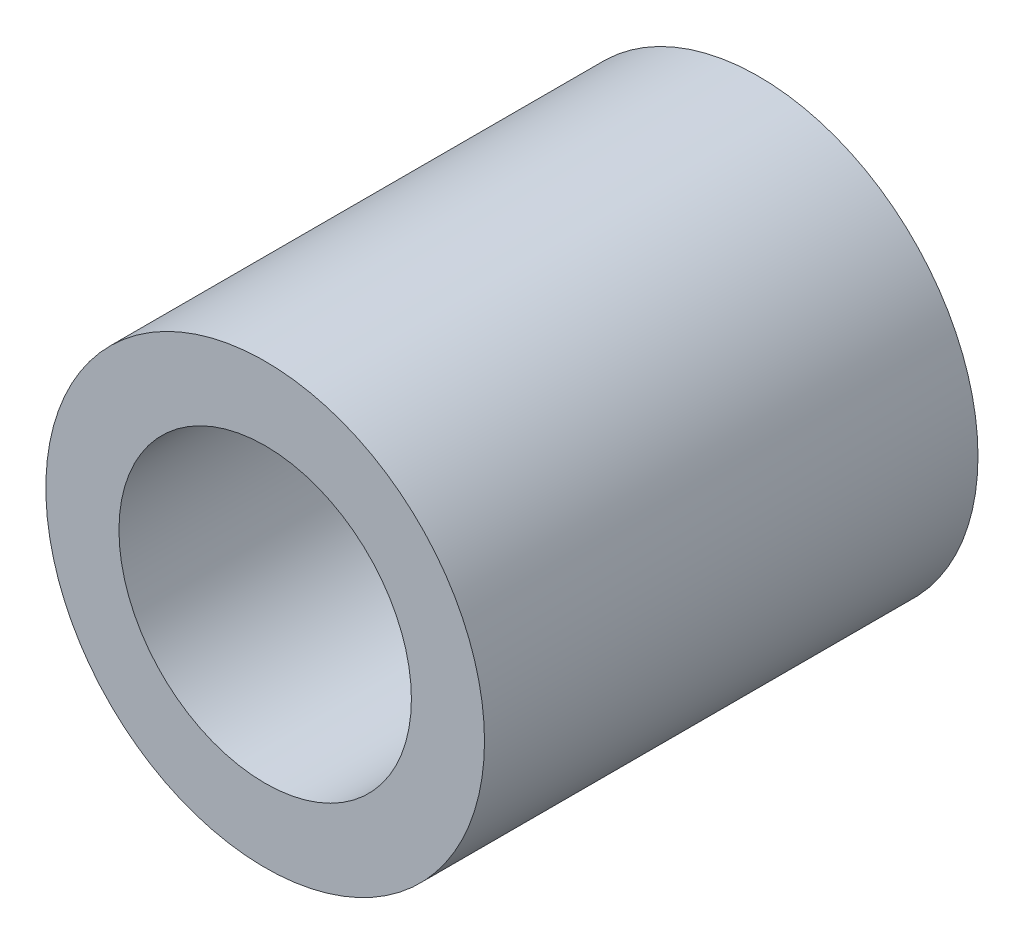
from build123d import *

# Parameters (mm, degrees)
SKETCH1_R           = 2.38125
SKETCH1_R_2         = 1.5875
BOSS_EXTRUDE1_DEPTH = 5.3578125


with BuildPart() as part:
    # Sketch1 → Boss-Extrude1 (new body)
    with BuildSketch(Plane.XY):
        Circle(SKETCH1_R)
        Circle(SKETCH1_R_2, mode=Mode.SUBTRACT)
    extrude(amount=BOSS_EXTRUDE1_DEPTH)


solid = part.part
